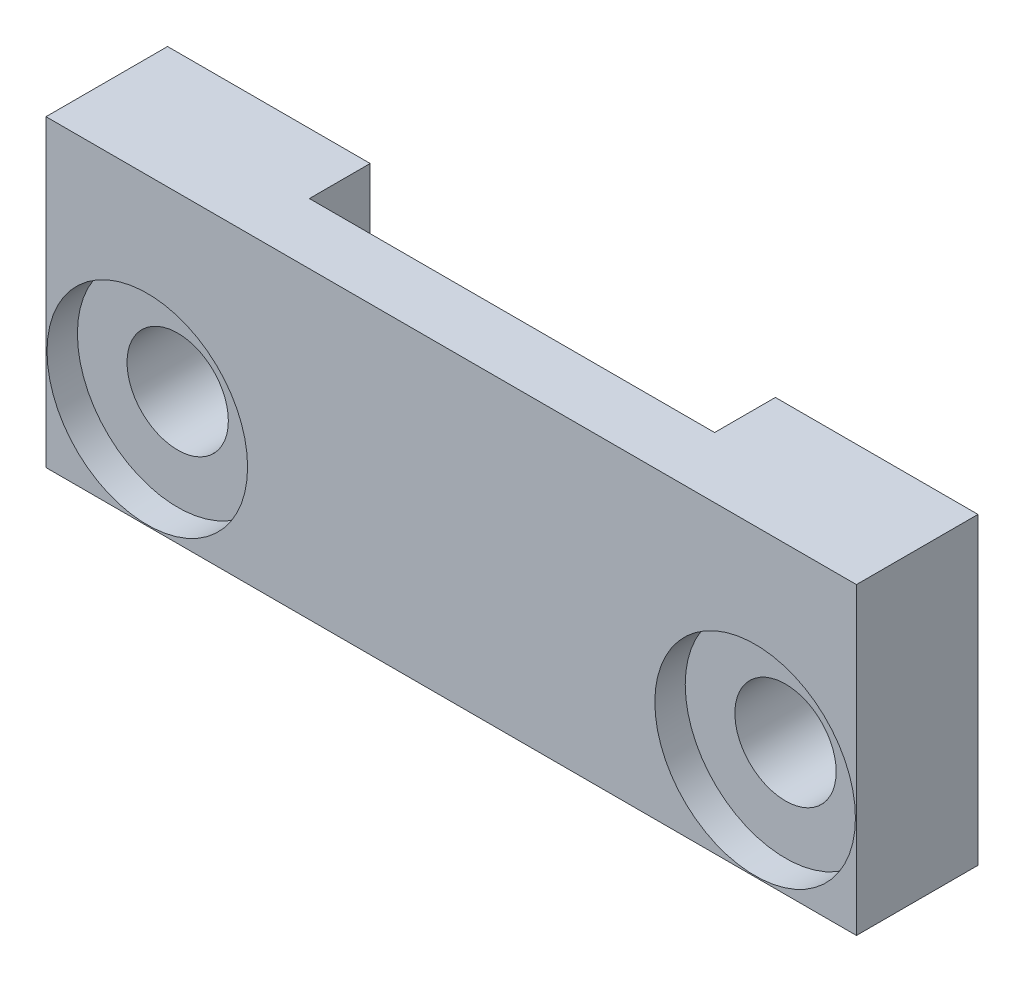
from build123d import *

# Parameters (mm, degrees)
SKETCH1_W           = 10
SKETCH1_H           = 15
SKETCH1_R           = 4.95
SKETCH1_R_2         = 2.5
BOSS_EXTRUDE1_DEPTH = 3
BOSS_EXTRUDE2_START = -3
SKETCH1_3_W         = 10
SKETCH1_3_H         = 15
SKETCH1_3_R         = 4.95
SKETCH1_3_R_2       = 2.5
BOSS_EXTRUDE2_DEPTH = 3
CUT_EXTRUDE1_START  = 1.5
SKETCH1_4_R         = 4.95
SKETCH1_4_R_2       = 2.5
CUT_EXTRUDE1_DEPTH  = 1.5


with BuildPart() as part:
    # Sketch1 → Boss-Extrude1 (new body)
    # profile 1 of 6: a face of its own
    with BuildSketch(Plane.XY):
        with Locations((-37.532834977, 11.935892272)):
            Rectangle(SKETCH1_W, SKETCH1_H)
        with Locations((-37.532834977, 9.435892272)):
            Circle(SKETCH1_R, mode=Mode.SUBTRACT)
    # profile 2 of 6: a face of its own
    with BuildSketch(Plane.XY):
        with Locations((-37.532834977, 9.435892272)):
            Circle(SKETCH1_R)
        with Locations((-37.532834977, 9.435892272)):
            Circle(SKETCH1_R_2, mode=Mode.SUBTRACT)
    # profile 3 of 6: a face of its own
    with BuildSketch(Plane.XY):
        with Locations((-7.532834977, 11.935892272)):
            Rectangle(SKETCH1_W, SKETCH1_H)
        with Locations((-7.532834977, 9.435892272)):
            Circle(SKETCH1_R, mode=Mode.SUBTRACT)
    # profile 4 of 6: a face of its own
    with BuildSketch(Plane.XY):
        with Locations((-7.532834977, 9.435892272)):
            Circle(SKETCH1_R)
        with Locations((-7.532834977, 9.435892272)):
            Circle(SKETCH1_R_2, mode=Mode.SUBTRACT)
    # profile 5 of 6: a face of its own
    with BuildSketch(Plane.XY):
        with Locations((-17.532834977, 11.935892272)):
            Rectangle(SKETCH1_W, SKETCH1_H)
    # profile 6 of 6: a face of its own
    with BuildSketch(Plane.XY):
        with Locations((-27.532834977, 11.935892272)):
            Rectangle(SKETCH1_W, SKETCH1_H)
    extrude(amount=BOSS_EXTRUDE1_DEPTH)

    # Sketch1<3> → Boss-Extrude2 (add)
    # profile 1 of 4: a face of its own
    with BuildSketch(Plane.XY.offset(BOSS_EXTRUDE2_START)):
        with Locations((-37.532834977, 11.935892272)):
            Rectangle(SKETCH1_3_W, SKETCH1_3_H)
        with Locations((-37.532834977, 9.435892272)):
            Circle(SKETCH1_3_R, mode=Mode.SUBTRACT)
    # profile 2 of 4: a face of its own
    with BuildSketch(Plane.XY.offset(BOSS_EXTRUDE2_START)):
        with Locations((-37.532834977, 9.435892272)):
            Circle(SKETCH1_3_R)
        with Locations((-37.532834977, 9.435892272)):
            Circle(SKETCH1_3_R_2, mode=Mode.SUBTRACT)
    # profile 3 of 4: a face of its own
    with BuildSketch(Plane.XY.offset(BOSS_EXTRUDE2_START)):
        with Locations((-7.532834977, 11.935892272)):
            Rectangle(SKETCH1_3_W, SKETCH1_3_H)
        with Locations((-7.532834977, 9.435892272)):
            Circle(SKETCH1_3_R, mode=Mode.SUBTRACT)
    # profile 4 of 4: a face of its own
    with BuildSketch(Plane.XY.offset(BOSS_EXTRUDE2_START)):
        with Locations((-7.532834977, 9.435892272)):
            Circle(SKETCH1_3_R)
        with Locations((-7.532834977, 9.435892272)):
            Circle(SKETCH1_3_R_2, mode=Mode.SUBTRACT)
    extrude(amount=BOSS_EXTRUDE2_DEPTH)

    # Sketch1<4> → Cut-Extrude1 (cut)
    # profile 1 of 2: a face of its own
    with BuildSketch(Plane.XY.offset(CUT_EXTRUDE1_START)):
        with Locations((-37.532834977, 9.435892272)):
            Circle(SKETCH1_4_R)
        with Locations((-37.532834977, 9.435892272)):
            Circle(SKETCH1_4_R_2, mode=Mode.SUBTRACT)
    # profile 2 of 2: a face of its own
    with BuildSketch(Plane.XY.offset(CUT_EXTRUDE1_START)):
        with Locations((-7.532834977, 9.435892272)):
            Circle(SKETCH1_4_R)
        with Locations((-7.532834977, 9.435892272)):
            Circle(SKETCH1_4_R_2, mode=Mode.SUBTRACT)
    extrude(amount=CUT_EXTRUDE1_DEPTH, mode=Mode.SUBTRACT)


solid = part.part
